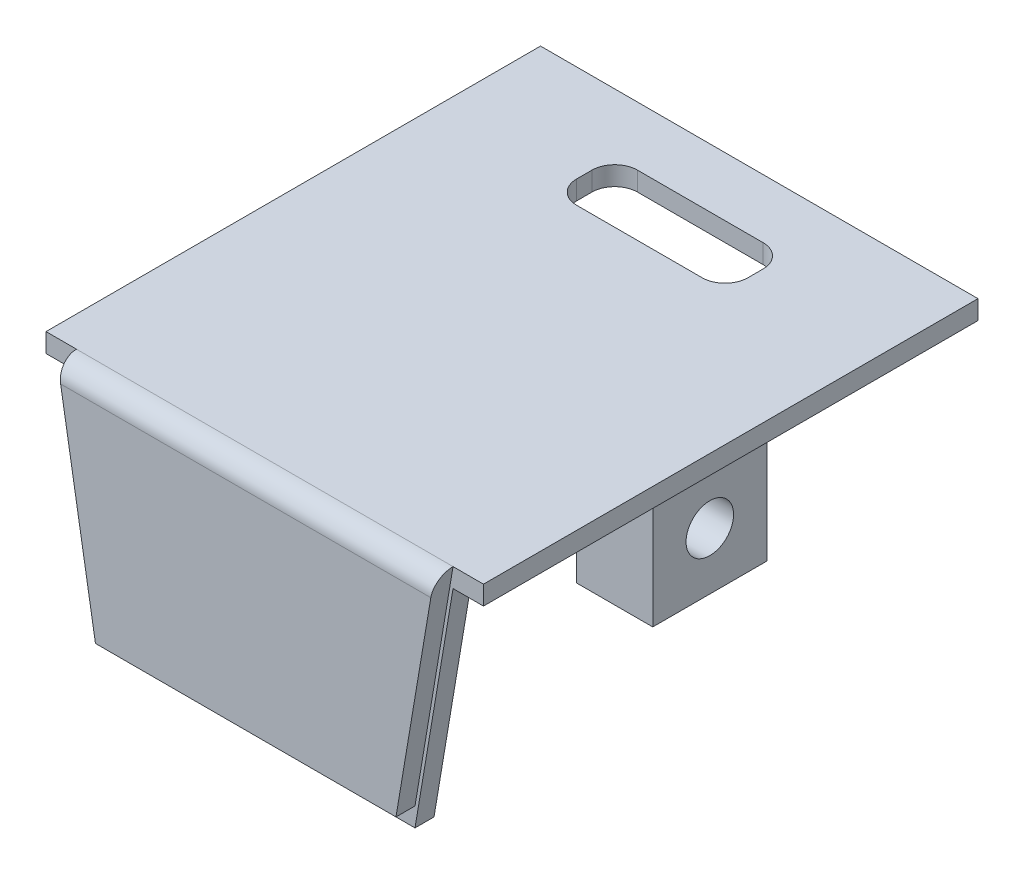
from build123d import *

# Parameters (mm, degrees)
SKIZZE1_W                       = 23
SKIZZE1_H                       = 26
AUFSATZ_LINEAR_AUSTRAGEN1_DEPTH = 1
SKIZZE2_W                       = 4
SKIZZE2_H                       = 6
AUFSATZ_LINEAR_AUSTRAGEN2_DEPTH = 6.5
SKIZZE3_R                       = 1.25
SCHNITT_LINEAR_AUSTRAGEN1_DEPTH = 4
AUFSATZ_LINEAR_AUSTRAGEN3_DEPTH = 1
AUFSATZ_LINEAR_AUSTRAGEN4_DEPTH = 1
SCHNITT_LINEAR_AUSTRAGEN2_DEPTH = 1
VERRUNDUNG1_R                   = 1


with BuildPart() as part:
    # Skizze1 → Aufsatz-Linear austragen1 (new body)
    with BuildSketch(Plane(origin=(0, 0, 0), x_dir=(1, 0, 0), z_dir=(0, 1, 0))):
        Rectangle(SKIZZE1_W, SKIZZE1_H)
    extrude(amount=AUFSATZ_LINEAR_AUSTRAGEN1_DEPTH)

    # Skizze2 → Aufsatz-Linear austragen2 (add)
    with BuildSketch(Plane.XZ):
        with Locations((8.4, 0)):
            Rectangle(SKIZZE2_W, SKIZZE2_H)
    aufsatz_linear_austragen2 = extrude(amount=AUFSATZ_LINEAR_AUSTRAGEN2_DEPTH)

    # Skizze3 → Schnitt-Linear austragen1 (cut)
    with BuildSketch(Plane(origin=(10.4, 0, 0), x_dir=(0, 0, -1), z_dir=(1, 0, 0))):
        with Locations((0, -3.5)):
            Circle(SKIZZE3_R)
    schnitt_linear_austragen1 = extrude(amount=-SCHNITT_LINEAR_AUSTRAGEN1_DEPTH, mode=Mode.SUBTRACT)

    # Spiegeln1: Aufsatz-Linear austragen2, Schnitt-Linear austragen1 across plane
    add(aufsatz_linear_austragen2.mirror(Plane(origin=(0, 0, 0), x_dir=(0, 0, 1), z_dir=(1, 0, 0))))
    add(schnitt_linear_austragen1.mirror(Plane(origin=(0, 0, 0), x_dir=(0, 0, 1), z_dir=(1, 0, 0))), mode=Mode.SUBTRACT)

    # Skizze4 → Aufsatz-Linear austragen3 (add)
    with BuildSketch(Plane.XY.offset(13)):
        Polygon((9.9, 1), (-9.9, 1), (-7.9, -10.9), (7.9, -10.9), align=None)
    extrude(amount=AUFSATZ_LINEAR_AUSTRAGEN3_DEPTH)

    # Skizze5 → Aufsatz-Linear austragen4 (add)
    with BuildSketch(Plane(origin=(0, 0, 13), x_dir=(-1, 0, 0), z_dir=(0, 0, -1))):
        Polygon((-7.9, -11.9), (7.9, -11.9), (9.9, 0), (-9.9, 0), align=None)
    extrude(amount=AUFSATZ_LINEAR_AUSTRAGEN4_DEPTH)

    # Skizze6 → Schnitt-Linear austragen2 (cut)
    with BuildSketch(Plane(origin=(0, 1, 0), x_dir=(1, 0, 0), z_dir=(0, 1, 0))):
        with BuildLine():
            Line((3.3, 9.9), (-3.3, 9.9))
            ThreePointArc((-3.3, 9.9), (-4.148528137, 9.548528137), (-4.5, 8.7))
            Line((-4.5, 8.7), (-4.5, 7.9))
            ThreePointArc((-4.5, 7.9), (-4.148528137, 7.051471863), (-3.3, 6.7))
            Line((-3.3, 6.7), (3.3, 6.7))
            ThreePointArc((3.3, 6.7), (4.148528137, 7.051471863), (4.5, 7.9))
            Line((4.5, 7.9), (4.5, 8.7))
            ThreePointArc((4.5, 8.7), (4.148528137, 9.548528137), (3.3, 9.9))
        make_face()
    extrude(amount=-SCHNITT_LINEAR_AUSTRAGEN2_DEPTH, mode=Mode.SUBTRACT)

    # Verrundung1
    verrundung1_edges = [part.edges().sort_by_distance(p)[0] for p in [
        (0, 1, 14),
    ]]
    fillet(verrundung1_edges, radius=VERRUNDUNG1_R)


solid = part.part
